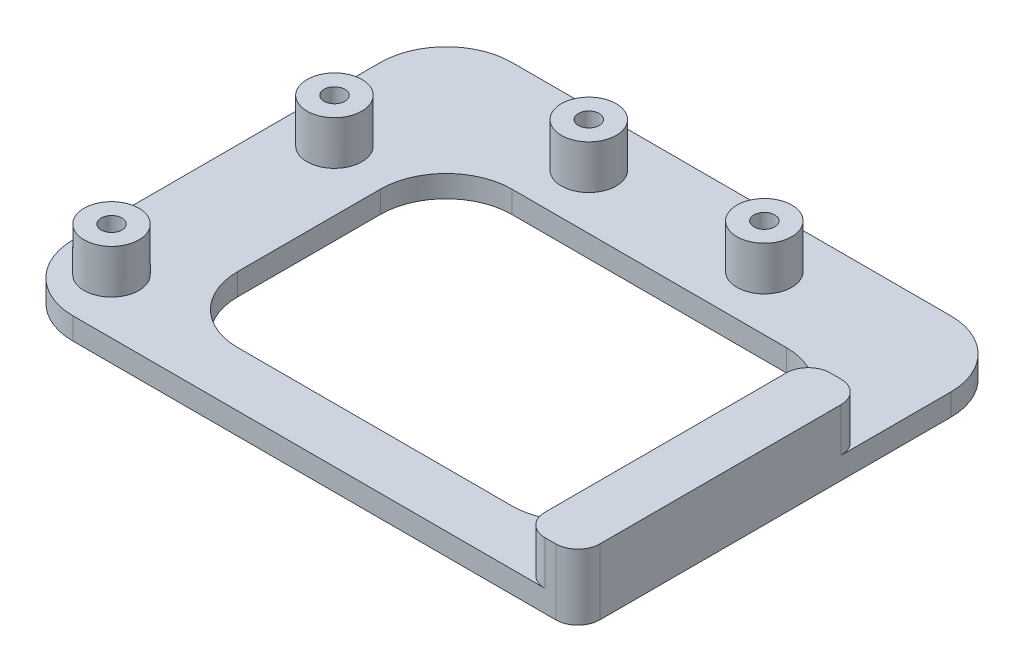
from build123d import *

# Parameters (mm, degrees)
SKETCH1_W           = 52
SKETCH1_H           = 40
BOSS_EXTRUDE1_DEPTH = 2
SKETCH2_R           = 0.95
CUT_EXTRUDE1_DEPTH  = 33.86335345
BOSS_EXTRUDE2_START = 4
SKETCH3_R           = 2.5
SKETCH3_R_2         = 0.95
BOSS_EXTRUDE2_DEPTH = 4
SKETCH4_W           = 5
SKETCH4_H           = 26
BOSS_EXTRUDE3_DEPTH = 4
SKETCH5_W           = 37
SKETCH5_H           = 25
CUT_EXTRUDE2_DEPTH  = 34.045423284
FILLET1_R           = 2
FILLET2_R           = 6


with BuildPart() as part:
    # Sketch1 → Boss-Extrude1 (new body)
    with BuildSketch(Plane(origin=(0, 0, 0), x_dir=(1, 0, 0), z_dir=(0, 1, 0))):
        Rectangle(SKETCH1_W, SKETCH1_H)
    extrude(amount=BOSS_EXTRUDE1_DEPTH)

    # Sketch2 → Cut-Extrude1 (cut, through all)
    with BuildSketch(Plane(origin=(0, 2, 0), x_dir=(1, 0, 0), z_dir=(0, 1, 0))):
        with Locations(Location((8, 15, 0), (0, 0, 270))):
            Circle(SKETCH2_R)
        with Locations(Location((-8, 15, 0), (0, 0, 270))):
            Circle(SKETCH2_R)
        with Locations(Location((-21.5, 5.32, 0), (0, 0, 270))):
            Circle(SKETCH2_R)
        with Locations(Location((-21.5, -15, 0), (0, 0, 270))):
            Circle(SKETCH2_R)
    extrude(amount=-CUT_EXTRUDE1_DEPTH, mode=Mode.SUBTRACT)

    # Sketch3 → Boss-Extrude2 (add)
    # profile 1 of 4: a face of its own
    with BuildSketch(Plane(origin=(0, 2, 0), x_dir=(1, 0, 0), z_dir=(0, 1, 0)).offset(BOSS_EXTRUDE2_START)):
        with Locations(Location((-21.5, 5.32, 0), (0, 0, 90))):
            Circle(SKETCH3_R)
        with Locations(Location((-21.5, 5.32, 0), (0, 0, 270))):
            Circle(SKETCH3_R_2, mode=Mode.SUBTRACT)
    # profile 2 of 4: a face of its own
    with BuildSketch(Plane(origin=(0, 2, 0), x_dir=(1, 0, 0), z_dir=(0, 1, 0)).offset(BOSS_EXTRUDE2_START)):
        with Locations(Location((-21.5, -15, 0), (0, 0, 90))):
            Circle(SKETCH3_R)
        with Locations(Location((-21.5, -15, 0), (0, 0, 270))):
            Circle(SKETCH3_R_2, mode=Mode.SUBTRACT)
    # profile 3 of 4: a face of its own
    with BuildSketch(Plane(origin=(0, 2, 0), x_dir=(1, 0, 0), z_dir=(0, 1, 0)).offset(BOSS_EXTRUDE2_START)):
        with Locations(Location((8, 15, 0), (0, 0, 90))):
            Circle(SKETCH3_R)
        with Locations(Location((8, 15, 0), (0, 0, 270))):
            Circle(SKETCH3_R_2, mode=Mode.SUBTRACT)
    # profile 4 of 4: a face of its own
    with BuildSketch(Plane(origin=(0, 2, 0), x_dir=(1, 0, 0), z_dir=(0, 1, 0)).offset(BOSS_EXTRUDE2_START)):
        with Locations(Location((-8, 15, 0), (0, 0, 90))):
            Circle(SKETCH3_R)
        with Locations(Location((-8, 15, 0), (0, 0, 270))):
            Circle(SKETCH3_R_2, mode=Mode.SUBTRACT)
    extrude(amount=-BOSS_EXTRUDE2_DEPTH)

    # Sketch4 → Boss-Extrude3 (add)
    with BuildSketch(Plane(origin=(0, 2, 0), x_dir=(1, 0, 0), z_dir=(0, 1, 0))):
        with Locations((23.5, -7)):
            Rectangle(SKETCH4_W, SKETCH4_H)
    extrude(amount=BOSS_EXTRUDE3_DEPTH)

    # Sketch5 → Cut-Extrude2 (cut, through all)
    with BuildSketch(Plane(origin=(0, 2, 0), x_dir=(1, 0, 0), z_dir=(0, 1, 0))):
        with Locations((2.5, -2.5)):
            Rectangle(SKETCH5_W, SKETCH5_H)
    extrude(amount=-CUT_EXTRUDE2_DEPTH, mode=Mode.SUBTRACT)

    # Fillet1
    fillet1_edges = [part.edges().sort_by_distance(p)[0] for p in [
        (26, 4, -6),
        (21, 4, -6),
        (21, 4, 20),
        (26, 3, 20),
    ]]
    fillet(fillet1_edges, radius=FILLET1_R)

    # Fillet2
    fillet2_edges = [part.edges().sort_by_distance(p)[0] for p in [
        (-16, 1, 15),
        (-16, 1, -10),
        (21, 1, -10),
        (21, 1, 15),
        (-26, 1, 20),
        (-26, 1, -20),
        (26, 1, -20),
    ]]
    fillet(fillet2_edges, radius=FILLET2_R)


solid = part.part
